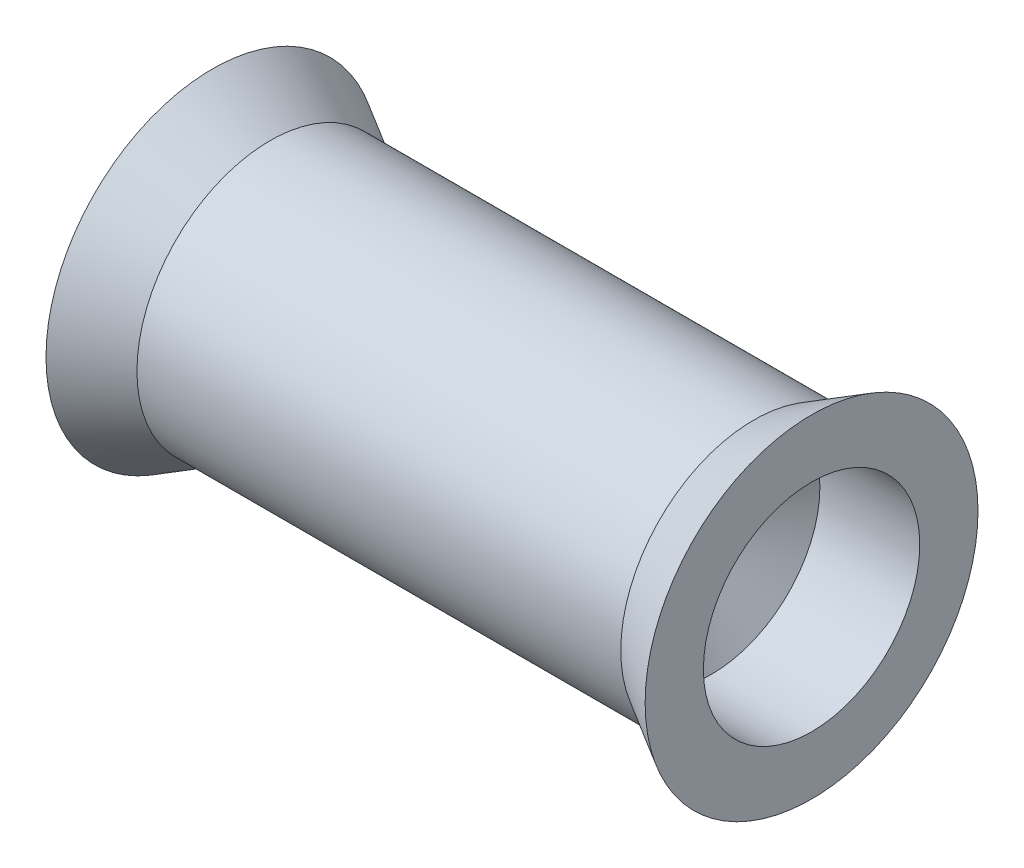
from build123d import *

# Parameters (mm, degrees)
SKETCH1_W = 20
SKETCH1_H = 4
SKETCH2_W = 2
SKETCH2_H = 5


with BuildPart() as part:
    # Sketch1 → Base-Revolve (revolve)
    with BuildSketch(Plane.XY, mode=Mode.PRIVATE) as base_revolve_sk:
        with Locations((0, 2)):
            Rectangle(SKETCH1_W, SKETCH1_H)
    revolve(base_revolve_sk.sketch.rotate(Axis((-30, 0, 0), (1, 0, 0)), 90), axis=Axis((-30, 0, 0), (1, 0, 0)))

    # Sketch2 → Cut-to-GripLength (revolve, cut)
    with BuildSketch(Plane.XY):
        with Locations((-10, 2.5)):
            Rectangle(SKETCH2_W, SKETCH2_H)
        with Locations((10, 2.5)):
            Rectangle(SKETCH2_W, SKETCH2_H)
    revolve(axis=Axis((-30, 0, 0), (1, 0, 0)), mode=Mode.SUBTRACT)

    # Sketch4 → HeadTypeB (revolve)
    with BuildSketch(Plane.XY, mode=Mode.PRIVATE) as headtypeb_sk:
        Polygon((-9, 0), (-9, 5), (-7.267949192, 4), (-7.267949192, 0), align=None)
        Polygon((7.267949192, 0), (9, 0), (9, 5), (7.267949192, 4), align=None)
    revolve(headtypeb_sk.sketch.rotate(Axis((-20, 0, 0), (1, 0, 0)), 90), axis=Axis((-20, 0, 0), (1, 0, 0)))

    # Sketch5 → HoleTypeA (revolve, cut)
    with BuildSketch(Plane.XY, mode=Mode.PRIVATE) as holetypea_sk:
        Polygon((-4.123611625, 0), (-6, 3.25), (-10, 3.25), (-10, 0), align=None)
        Polygon((4.123611625, 0), (6, 3.25), (10, 3.25), (10, 0), align=None)
    revolve(holetypea_sk.sketch.rotate(Axis((-22, 0, 0), (1, 0, 0)), 90), axis=Axis((-22, 0, 0), (1, 0, 0)), mode=Mode.SUBTRACT)


solid = part.part
